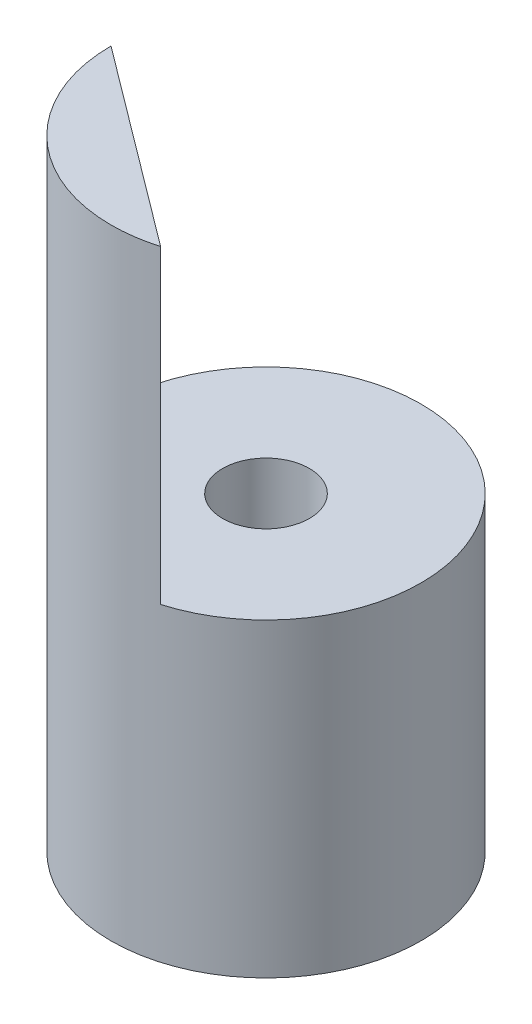
from build123d import *

# Parameters (mm, degrees)
CROQUIS1_R              = 7.5
SALIENTE_EXTRUIR1_DEPTH = 7.5
SALIENTE_EXTRUIR2_START = 15
SALIENTE_EXTRUIR2_DEPTH = 15
CROQUIS3_R              = 2.1
CORTAR_EXTRUIR2_DEPTH   = 19.371173071


with BuildPart() as part:
    # Croquis1 → Saliente-Extruir1 (new, symmetric)
    with BuildSketch(Plane(origin=(0, 0, 0), x_dir=(1, 0, 0), z_dir=(0, 1, 0))):
        with Locations(Location((0, 0, 0), (0, 0, 270))):
            Circle(CROQUIS1_R)
    extrude(amount=SALIENTE_EXTRUIR1_DEPTH, both=True)

    # Croquis2 → Saliente-Extruir2 (add)
    with BuildSketch(Plane(origin=(0, 7.5, 0), x_dir=(1, 0, 0), z_dir=(0, 1, 0)).offset(SALIENTE_EXTRUIR2_START)):
        with BuildLine():
            Line((2.1, -7.2), (-7.5, 0))
            ThreePointArc((-7.5, 0), (-4.5, -6), (2.1, -7.2))
        make_face()
    extrude(amount=-SALIENTE_EXTRUIR2_DEPTH)

    # Croquis3 → Cortar-Extruir2 (cut, through all)
    with BuildSketch(Plane(origin=(0, 7.5, 0), x_dir=(1, 0, 0), z_dir=(0, 1, 0))):
        with Locations(Location((0, 0, 0), (0, 0, 270))):
            Circle(CROQUIS3_R)
    extrude(amount=-CORTAR_EXTRUIR2_DEPTH, mode=Mode.SUBTRACT)


solid = part.part
